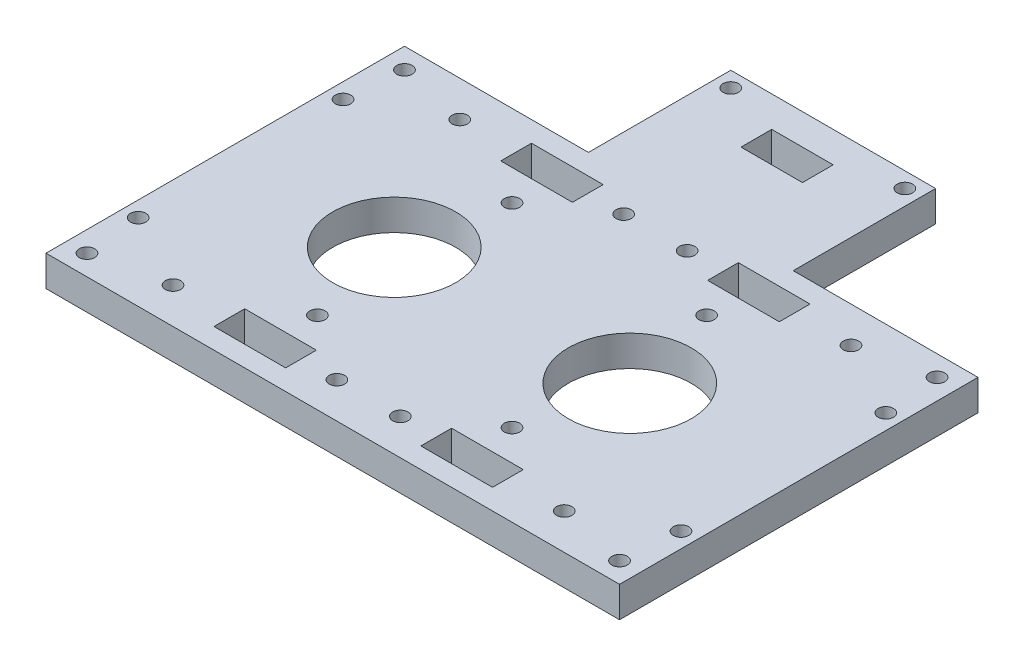
from build123d import *

# Parameters (mm, degrees)
SKETCH1_W           = 112
SKETCH1_H           = 70
SKETCH1_R           = 1.5
BOSS_EXTRUDE1_DEPTH = 6
SKETCH2_R           = 1.5
CUT_EXTRUDE1_DEPTH  = 85.504437753
SKETCH3_W           = 14
SKETCH3_H           = 6
CUT_EXTRUDE2_DEPTH  = 85.504437753
SKETCH4_R           = 1.5
CUT_EXTRUDE3_DEPTH  = 85.504437753
SKETCH5_R           = 12
CUT_EXTRUDE4_DEPTH  = 85.504437753
SKETCH6_R           = 1.5
CUT_EXTRUDE5_DEPTH  = 10
SKETCH7_W           = 40
SKETCH7_H           = 27.8
BOSS_EXTRUDE2_DEPTH = 6
SKETCH8_W           = 12
SKETCH8_H           = 6
CUT_EXTRUDE6_DEPTH  = 6
SKETCH9_R           = 1.5
CUT_EXTRUDE7_DEPTH  = 6


with BuildPart() as part:
    # Sketch1 → Boss-Extrude1 (new body)
    with BuildSketch(Plane(origin=(0, 0, 0), x_dir=(1, 0, 0), z_dir=(0, 1, 0))):
        with Locations((0, 28)):
            Rectangle(SKETCH1_W, SKETCH1_H)
        with Locations(Location((-6.2, 0, 0), (0, 0, 270))):
            Circle(SKETCH1_R, mode=Mode.SUBTRACT)
        with Locations(Location((-38.2, 0, 0), (0, 0, 270))):
            Circle(SKETCH1_R, mode=Mode.SUBTRACT)
        with Locations(Location((-6.2, 56, 0), (0, 0, 270))):
            Circle(SKETCH1_R, mode=Mode.SUBTRACT)
        with Locations(Location((-38.2, 56, 0), (0, 0, 270))):
            Circle(SKETCH1_R, mode=Mode.SUBTRACT)
        with Locations(Location((6.2, 0, 0), (0, 0, 90))):
            Circle(SKETCH1_R, mode=Mode.SUBTRACT)
        with Locations(Location((38.2, 0, 0), (0, 0, 90))):
            Circle(SKETCH1_R, mode=Mode.SUBTRACT)
        with Locations(Location((6.2, 56, 0), (0, 0, 90))):
            Circle(SKETCH1_R, mode=Mode.SUBTRACT)
        with Locations(Location((38.2, 56, 0), (0, 0, 90))):
            Circle(SKETCH1_R, mode=Mode.SUBTRACT)
    extrude(amount=BOSS_EXTRUDE1_DEPTH)

    # Sketch2 → Cut-Extrude1 (cut, through all)
    with BuildSketch(Plane(origin=(0, 6, 0), x_dir=(1, 0, 0), z_dir=(0, 1, 0))):
        with Locations(Location((-53, 48, 0), (0, 0, 270))):
            Circle(SKETCH2_R)
        with Locations(Location((-53, 8, 0), (0, 0, 270))):
            Circle(SKETCH2_R)
        with Locations(Location((53, 8, 0), (0, 0, 270))):
            Circle(SKETCH2_R)
        with Locations(Location((53, 48, 0), (0, 0, 270))):
            Circle(SKETCH2_R)
    extrude(amount=-CUT_EXTRUDE1_DEPTH, mode=Mode.SUBTRACT)

    # Sketch3 → Cut-Extrude2 (cut, through all)
    with BuildSketch(Plane(origin=(0, 6, 0), x_dir=(1, 0, 0), z_dir=(0, 1, 0))):
        with Locations((20.2, 56)):
            Rectangle(SKETCH3_W, SKETCH3_H)
        with Locations((20.2, 0)):
            Rectangle(SKETCH3_W, SKETCH3_H)
        with Locations((-20.2, 0)):
            Rectangle(SKETCH3_W, SKETCH3_H)
        with Locations((-20.2, 56)):
            Rectangle(SKETCH3_W, SKETCH3_H)
    extrude(amount=-CUT_EXTRUDE2_DEPTH, mode=Mode.SUBTRACT)

    # Sketch4 → Cut-Extrude3 (cut, through all)
    with BuildSketch(Plane(origin=(0, 6, 0), x_dir=(1, 0, 0), z_dir=(0, 1, 0))):
        with Locations(Location((19, 9, 0), (0, 0, 270))):
            Circle(SKETCH4_R)
        with Locations(Location((19, 47, 0), (0, 0, 90))):
            Circle(SKETCH4_R)
        with Locations(Location((-19, 47, 0), (0, 0, 270))):
            Circle(SKETCH4_R)
        with Locations(Location((-19, 9, 0), (0, 0, 90))):
            Circle(SKETCH4_R)
    extrude(amount=-CUT_EXTRUDE3_DEPTH, mode=Mode.SUBTRACT)

    # Sketch5 → Cut-Extrude4 (cut, through all)
    with BuildSketch(Plane(origin=(0, 6, 0), x_dir=(1, 0, 0), z_dir=(0, 1, 0))):
        with Locations(Location((-23, 28, 0), (0, 0, 270))):
            Circle(SKETCH5_R)
        with Locations(Location((23, 28, 0), (0, 0, 270))):
            Circle(SKETCH5_R)
    extrude(amount=-CUT_EXTRUDE4_DEPTH, mode=Mode.SUBTRACT)

    # Sketch6 → Cut-Extrude5 (cut)
    with BuildSketch(Plane(origin=(0, 6, 0), x_dir=(1, 0, 0), z_dir=(0, 1, 0))):
        with Locations(Location((-52, 59, 0), (0, 0, 270))):
            Circle(SKETCH6_R)
        with Locations(Location((52, 59, 0), (0, 0, 270))):
            Circle(SKETCH6_R)
        with Locations(Location((52, -3, 0), (0, 0, 270))):
            Circle(SKETCH6_R)
        with Locations(Location((-52, -3, 0), (0, 0, 270))):
            Circle(SKETCH6_R)
    extrude(amount=-CUT_EXTRUDE5_DEPTH, mode=Mode.SUBTRACT)

    # Sketch7 → Boss-Extrude2 (add)
    with BuildSketch(Plane(origin=(0, 0, 0), x_dir=(1, 0, 0), z_dir=(0, 1, 0))):
        with Locations((-0.079368114, 76.9)):
            Rectangle(SKETCH7_W, SKETCH7_H)
    extrude(amount=BOSS_EXTRUDE2_DEPTH)

    # Sketch8 → Cut-Extrude6 (cut)
    with BuildSketch(Plane(origin=(0, 6, 0), x_dir=(1, 0, 0), z_dir=(0, 1, 0))):
        with Locations((-0.079368114, 81.8)):
            Rectangle(SKETCH8_W, SKETCH8_H)
    extrude(amount=-CUT_EXTRUDE6_DEPTH, mode=Mode.SUBTRACT)

    # Sketch9 → Cut-Extrude7 (cut)
    with BuildSketch(Plane(origin=(0, 6, 0), x_dir=(1, 0, 0), z_dir=(0, 1, 0))):
        with Locations(Location((-17.079368114, 87.8, 0), (0, 0, 270))):
            Circle(SKETCH9_R)
        with Locations(Location((16.920631886, 87.8, 0), (0, 0, 270))):
            Circle(SKETCH9_R)
    extrude(amount=-CUT_EXTRUDE7_DEPTH, mode=Mode.SUBTRACT)


solid = part.part
